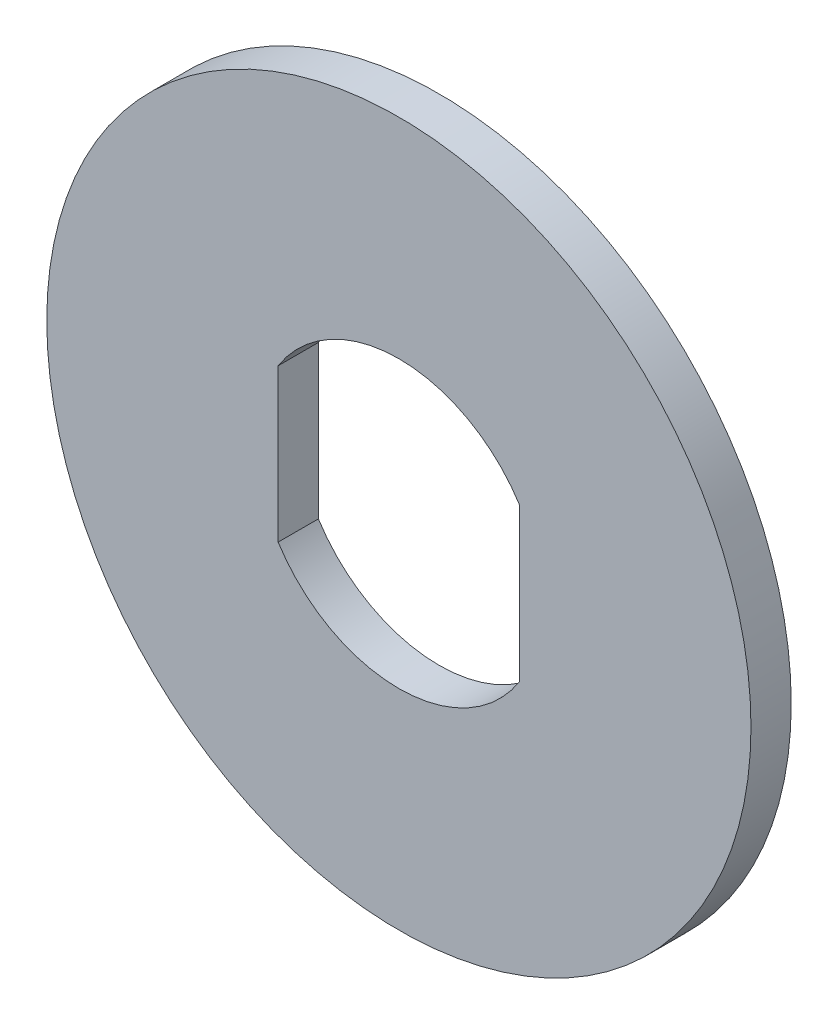
from build123d import *

# Parameters (mm, degrees)
ESQUISSE1_R      = 17.5
EXTRUSION1_DEPTH = 2


with BuildPart() as part:
    # Esquisse1 → Extrusion1 (new body)
    with BuildSketch(Plane.XY):
        Circle(ESQUISSE1_R)
        with BuildLine():
            Line((-6, 3.796050579), (-6, -3.796050579))
            ThreePointArc((-6, -3.796050579), (0, -7.1), (6, -3.796050579))
            Line((6, -3.796050579), (6, 3.796050579))
            ThreePointArc((6, 3.796050579), (0, 7.1), (-6, 3.796050579))
        make_face(mode=Mode.SUBTRACT)
    extrude(amount=EXTRUSION1_DEPTH)


solid = part.part
